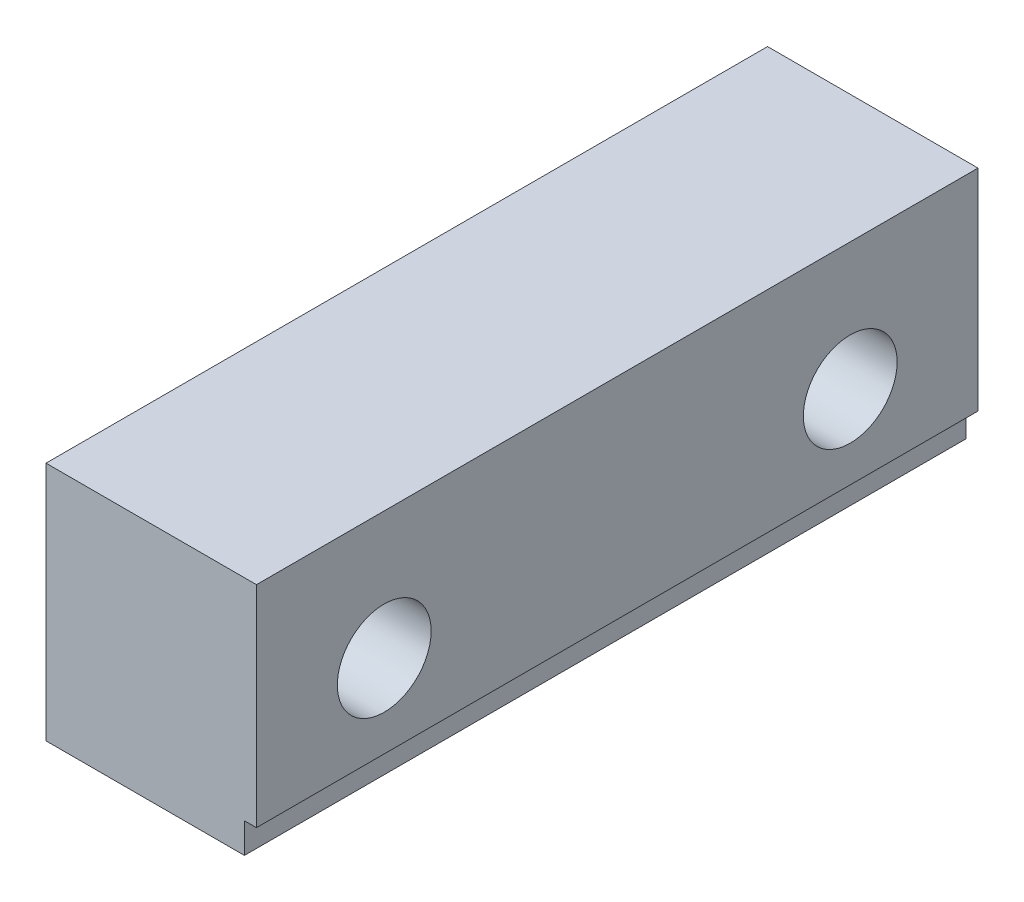
from build123d import *

# Parameters (mm, degrees)
SKETCH1_W           = 44.45
SKETCH1_H           = 50.8
BOSS_EXTRUDE1_DEPTH = 76.2
CUT_EXTRUDE1_REACH  = 93.801
SKETCH2_R           = 6.731
SKETCH3_R           = 9.906
CUT_EXTRUDE2_DEPTH  = 38.608
SKETCH4_W           = 2.54
SKETCH4_H           = 6.35
CUT_EXTRUDE4_DEPTH  = 157.092506627


with BuildPart() as part:
    # Sketch1 → Boss-Extrude1 (new, symmetric)
    with BuildSketch(Plane.XY):
        Rectangle(SKETCH1_W, SKETCH1_H)
    extrude(amount=BOSS_EXTRUDE1_DEPTH, both=True)

    # Sketch2 → Cut-Extrude1 (cut, up to next)
    with BuildSketch(Plane(origin=(22.225, 0, 0), x_dir=(0, 0, -1), z_dir=(1, 0, 0)), mode=Mode.PRIVATE) as cut_extrude1_sk1:
        with Locations((-49.2125, -1.524)):
            Circle(SKETCH2_R)
    cut_extrude1_tool1 = extrude(cut_extrude1_sk1.sketch, amount=-CUT_EXTRUDE1_REACH, mode=Mode.PRIVATE) & part.part
    # Sketch2 → Cut-Extrude1 (cut, up to next)
    with BuildSketch(Plane(origin=(22.225, 0, 0), x_dir=(0, 0, -1), z_dir=(1, 0, 0)), mode=Mode.PRIVATE) as cut_extrude1_sk2:
        with Locations((49.2125, -1.524)):
            Circle(SKETCH2_R)
    cut_extrude1_tool2 = extrude(cut_extrude1_sk2.sketch, amount=-CUT_EXTRUDE1_REACH, mode=Mode.PRIVATE) & part.part
    add(cut_extrude1_tool1.solids().sort_by_distance((22.225, -1.524, 49.2125))[0], mode=Mode.SUBTRACT)
    add(cut_extrude1_tool2.solids().sort_by_distance((22.225, -1.524, -49.2125))[0], mode=Mode.SUBTRACT)

    # Sketch3 → Cut-Extrude2 (cut)
    with BuildSketch(Plane(origin=(22.225, 0, 0), x_dir=(0, 0, -1), z_dir=(1, 0, 0))):
        with Locations((-49.2125, -1.524)):
            Circle(SKETCH3_R)
        with Locations((49.2125, -1.524)):
            Circle(SKETCH3_R)
    extrude(amount=-CUT_EXTRUDE2_DEPTH, mode=Mode.SUBTRACT)

    # Sketch4 → Cut-Extrude4 (cut, through all)
    with BuildSketch(Plane.XY.offset(76.2)):
        with Locations((20.955, -22.225)):
            Rectangle(SKETCH4_W, SKETCH4_H)
    extrude(amount=-CUT_EXTRUDE4_DEPTH, mode=Mode.SUBTRACT)


solid = part.part
